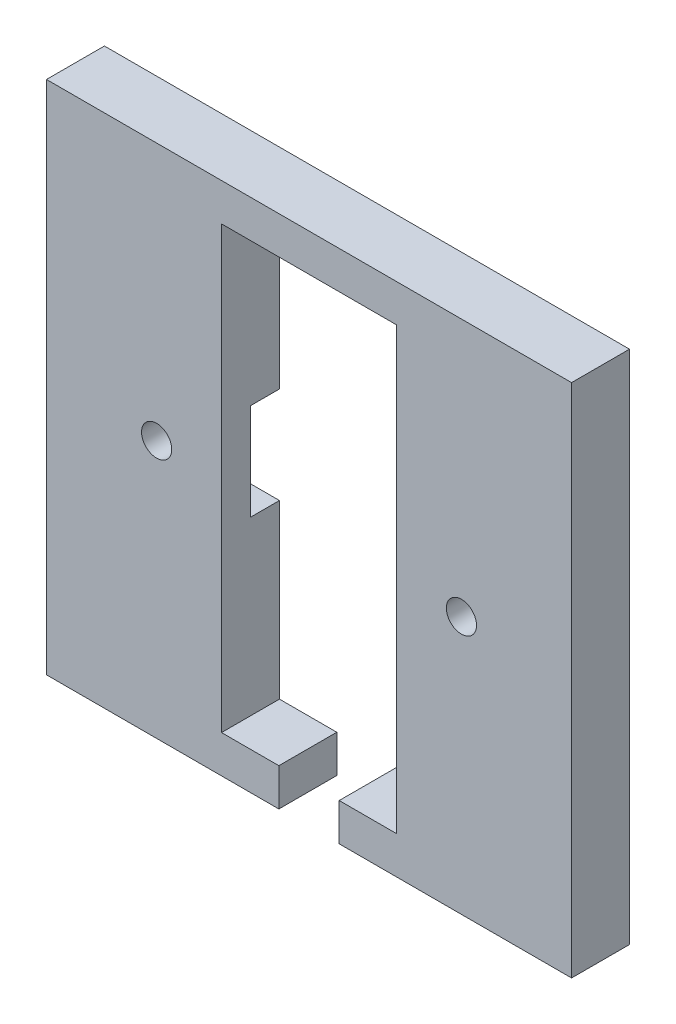
from build123d import *

# Parameters (mm, degrees)
BOSS_EXTRUDE1_DEPTH     = 4.8
CUT_EXTRUDE1_DEPTH      = 31.859144724
CUT_EXTRUDE1_DEPTH_BACK = 31.859144724
CUT_EXTRUDE2_DEPTH      = 31.859144724
CUT_EXTRUDE2_DEPTH_BACK = 31.859144724
SKETCH1_13_R            = 1.25
SKETCH1_15_W            = 12
SKETCH1_15_H            = 8
SKETCH1_15_R            = 1.25
CUT_EXTRUDE4_DEPTH      = 2.4
SKETCH2_W               = 5
SKETCH2_H               = 3.108471694
CUT_EXTRUDE5_DEPTH      = 31.859144724


with BuildPart() as part:
    # Sketch1 → Boss-Extrude1 (new body)
    with BuildSketch(Plane.XY):
        Polygon((-21.75, 18.25), (-21.75, -18.25), (-21.75, -21.358471694), (21.75, -21.358471694), (21.75, -18.25), (21.75, 18.25), (21.75, 21.358471694), (-21.75, 21.358471694), align=None)
    extrude(amount=BOSS_EXTRUDE1_DEPTH)

    # Sketch1<12> → Cut-Extrude1 (cut, two sides: drawn at the far end of the back side and taken through both)
    with BuildSketch(Plane.XY.offset(-CUT_EXTRUDE1_DEPTH_BACK)):
        Polygon((-7.25, 18.25), (-7.25, 4), (-7.25, 0), (-7.25, -4), (-7.25, -18.25), (7.25, -18.25), (7.25, -4), (7.25, 0), (7.25, 4), (7.25, 18.25), align=None)
    extrude(amount=CUT_EXTRUDE1_DEPTH + CUT_EXTRUDE1_DEPTH_BACK, mode=Mode.SUBTRACT)

    # Sketch1<13> → Cut-Extrude2 (cut, two sides: drawn at the far end of the back side and taken through both)
    with BuildSketch(Plane.XY.offset(-CUT_EXTRUDE2_DEPTH_BACK)):
        with Locations((-12.625438214, 0)):
            Circle(SKETCH1_13_R)
        with Locations((12.625438214, 0)):
            Circle(SKETCH1_13_R)
    extrude(amount=CUT_EXTRUDE2_DEPTH + CUT_EXTRUDE2_DEPTH_BACK, mode=Mode.SUBTRACT)

    # Sketch1<15> → Cut-Extrude4 (cut)
    # profile 1 of 2: a face of its own
    with BuildSketch(Plane.XY):
        with Locations((-13.25, 0)):
            Rectangle(SKETCH1_15_W, SKETCH1_15_H)
        with Locations((-12.625438214, 0)):
            Circle(SKETCH1_15_R, mode=Mode.SUBTRACT)
    # profile 2 of 2: a face of its own
    with BuildSketch(Plane.XY):
        with Locations((13.25, 0)):
            Rectangle(SKETCH1_15_W, SKETCH1_15_H)
        with Locations((12.625438214, 0)):
            Circle(SKETCH1_15_R, mode=Mode.SUBTRACT)
    extrude(amount=CUT_EXTRUDE4_DEPTH, mode=Mode.SUBTRACT)

    # Sketch2 → Cut-Extrude5 (cut, through all)
    with BuildSketch(Plane(origin=(0, 0, 0), x_dir=(-1, 0, 0), z_dir=(0, 0, -1))):
        with Locations((0, -19.804235847)):
            Rectangle(SKETCH2_W, SKETCH2_H)
    extrude(amount=-CUT_EXTRUDE5_DEPTH, mode=Mode.SUBTRACT)


solid = part.part
